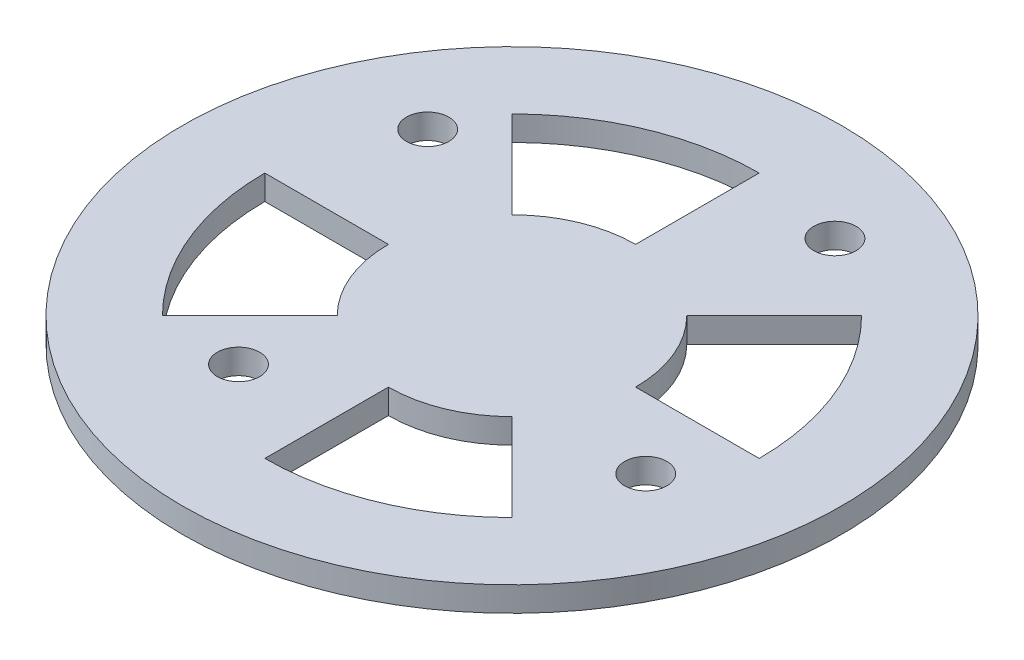
from build123d import *

# Parameters (mm, degrees)
SKETCH1_R           = 50.8
BOSS_EXTRUDE1_DEPTH = 19.05
CUT_EXTRUDE2_DEPTH  = 15.24
SKETCH5_R           = 4.064
CUT_EXTRUDE3_DEPTH  = 74.440708058
CUT_EXTRUDE4_DEPTH  = 75.324844433
SKETCH7_R           = 48.26
CUT_EXTRUDE5_DEPTH  = 15.24
SKETCH8_R           = 3.2639
CUT_EXTRUDE6_DEPTH  = 74.440708058
CUT_EXTRUDE7_START  = -15.24
SKETCH9_R           = 50.8
CUT_EXTRUDE7_DEPTH  = 15.24
SKETCH10_R          = 6.215985944
BOSS_EXTRUDE2_DEPTH = 3.81


with BuildPart() as part:
    # Sketch1 → Boss-Extrude1 (new body)
    with BuildSketch(Plane(origin=(0, 0, 0), x_dir=(1, 0, 0), z_dir=(0, 1, 0))):
        with Locations(Location((0, 0, 0), (0, 0, 90))):
            Circle(SKETCH1_R)
    extrude(amount=BOSS_EXTRUDE1_DEPTH)

    # Sketch4 → Cut-Extrude2 (cut)
    with BuildSketch(Plane(origin=(0, 19.05, 0), x_dir=(1, 0, 0), z_dir=(0, 1, 0))):
        Polygon((-3.519527241, 6.096), (3.519527241, 6.096), (7.039054482, 0), (3.519527241, -6.096), (-3.519527241, -6.096), (-7.039054482, 0), align=None)
    extrude(amount=-CUT_EXTRUDE2_DEPTH, mode=Mode.SUBTRACT)

    # Sketch5 → Cut-Extrude3 (cut, through all)
    with BuildSketch(Plane(origin=(0, 3.81, 0), x_dir=(1, 0, 0), z_dir=(0, 1, 0))):
        with Locations(Location((0, 0, 0), (0, 0, 270))):
            Circle(SKETCH5_R)
    extrude(amount=-CUT_EXTRUDE3_DEPTH, mode=Mode.SUBTRACT)

    # Sketch6 → Cut-Extrude4 (cut, through all)
    with BuildSketch(Plane(origin=(0, 19.05, 0), x_dir=(1, 0, 0), z_dir=(0, 1, 0))):
        with BuildLine():
            ThreePointArc((-13.470384182, 13.470384182), (-7.290119387, 17.599905094), (0, 19.05))
            Line((0, 19.05), (0, 38.1))
            ThreePointArc((0, 38.1), (-14.580238773, 35.199810189), (-26.940768363, 26.940768363))
            Line((-26.940768363, 26.940768363), (-13.470384182, 13.470384182))
        make_face()
        with BuildLine():
            Line((26.940768363, 26.940768363), (13.470384182, 13.470384182))
            ThreePointArc((13.470384182, 13.470384182), (17.599905094, 7.290119387), (19.05, 0))
            Line((19.05, 0), (38.1, 0))
            ThreePointArc((38.1, 0), (35.199810189, 14.580238773), (26.940768363, 26.940768363))
        make_face()
        with BuildLine():
            Line((26.940768363, -26.940768363), (13.470384182, -13.470384182))
            ThreePointArc((13.470384182, -13.470384182), (7.290119387, -17.599905094), (0, -19.05))
            Line((0, -19.05), (0, -38.1))
            ThreePointArc((0, -38.1), (14.580238773, -35.199810189), (26.940768363, -26.940768363))
        make_face()
        with BuildLine():
            Line((-26.940768363, -26.940768363), (-13.470384182, -13.470384182))
            ThreePointArc((-13.470384182, -13.470384182), (-17.599905094, -7.290119387), (-19.05, 0))
            Line((-19.05, 0), (-38.1, 0))
            ThreePointArc((-38.1, 0), (-35.199810189, -14.580238773), (-26.940768363, -26.940768363))
        make_face()
    extrude(amount=-CUT_EXTRUDE4_DEPTH, mode=Mode.SUBTRACT)

    # Sketch7 → Cut-Extrude5 (cut)
    with BuildSketch(Plane(origin=(0, 19.05, 0), x_dir=(1, 0, 0), z_dir=(0, 1, 0))):
        with Locations(Location((0, 0, 0), (0, 0, 270))):
            Circle(SKETCH7_R)
        with BuildLine():
            Line((-16.313445375, 2.54), (-40.560547334, 2.54))
            ThreePointArc((-40.560547334, 2.54), (-37.546464201, -15.552254691), (-26.884586844, -30.476689292))
            Line((-26.884586844, -30.476689292), (-9.739296625, -13.331399073))
            ThreePointArc((-9.739296625, -13.331399073), (-15.253251082, -6.318103468), (-16.313445375, 2.54))
        make_face(mode=Mode.SUBTRACT)
        with BuildLine():
            Line((16.313445375, -2.54), (40.560547334, -2.54))
            ThreePointArc((40.560547334, -2.54), (37.546464201, 15.552254691), (26.884586844, 30.476689292))
            Line((26.884586844, 30.476689292), (9.739296625, 13.331399073))
            ThreePointArc((9.739296625, 13.331399073), (15.253251082, 6.318103468), (16.313445375, -2.54))
        make_face(mode=Mode.SUBTRACT)
        Polygon((4.985996925, 8.636), (-4.985996925, 8.636), (-9.971993849, 0), (-4.985996925, -8.636), (4.985996925, -8.636), (9.971993849, 0), align=None, mode=Mode.SUBTRACT)
        with BuildLine():
            ThreePointArc((2.54, 40.560547334), (-15.552254691, 37.546464201), (-30.476689292, 26.884586844))
            Line((-30.476689292, 26.884586844), (-13.331399073, 9.739296625))
            ThreePointArc((-13.331399073, 9.739296625), (-6.318103468, 15.253251082), (2.54, 16.313445375))
            Line((2.54, 16.313445375), (2.54, 40.560547334))
        make_face(mode=Mode.SUBTRACT)
        with BuildLine():
            Line((-2.54, -16.313445375), (-2.54, -40.560547334))
            ThreePointArc((-2.54, -40.560547334), (15.552254691, -37.546464201), (30.476689292, -26.884586844))
            Line((30.476689292, -26.884586844), (13.331399073, -9.739296625))
            ThreePointArc((13.331399073, -9.739296625), (6.318103468, -15.253251082), (-2.54, -16.313445375))
        make_face(mode=Mode.SUBTRACT)
    extrude(amount=-CUT_EXTRUDE5_DEPTH, mode=Mode.SUBTRACT)

    # Sketch8 → Cut-Extrude6 (cut, through all)
    with BuildSketch(Plane(origin=(0, 3.81, 0), x_dir=(1, 0, 0), z_dir=(0, 1, 0))):
        with Locations(Location((14.580238773, 35.199810189, 0), (0, 0, 270))):
            Circle(SKETCH8_R)
        with Locations(Location((31.389810189, -10.770238773, 0), (0, 0, 270))):
            Circle(SKETCH8_R)
        with Locations(Location((-14.580238773, -27.579810189, 0), (0, 0, 270))):
            Circle(SKETCH8_R)
        with Locations(Location((-31.389810189, 18.390238773, 0), (0, 0, 270))):
            Circle(SKETCH8_R)
    extrude(amount=-CUT_EXTRUDE6_DEPTH, mode=Mode.SUBTRACT)

    # Sketch9 → Cut-Extrude7 (cut)
    with BuildSketch(Plane(origin=(0, 19.05, 0), x_dir=(1, 0, 0), z_dir=(0, 1, 0)).offset(CUT_EXTRUDE7_START)):
        with Locations(Location((0, 0, 0), (0, 0, 90))):
            Circle(SKETCH9_R)
    extrude(amount=CUT_EXTRUDE7_DEPTH, mode=Mode.SUBTRACT)

    # Sketch10 → Boss-Extrude2 (add)
    with BuildSketch(Plane(origin=(0, 3.81, 0), x_dir=(1, 0, 0), z_dir=(0, 1, 0))):
        Circle(SKETCH10_R)
    extrude(amount=-BOSS_EXTRUDE2_DEPTH)


solid = part.part
